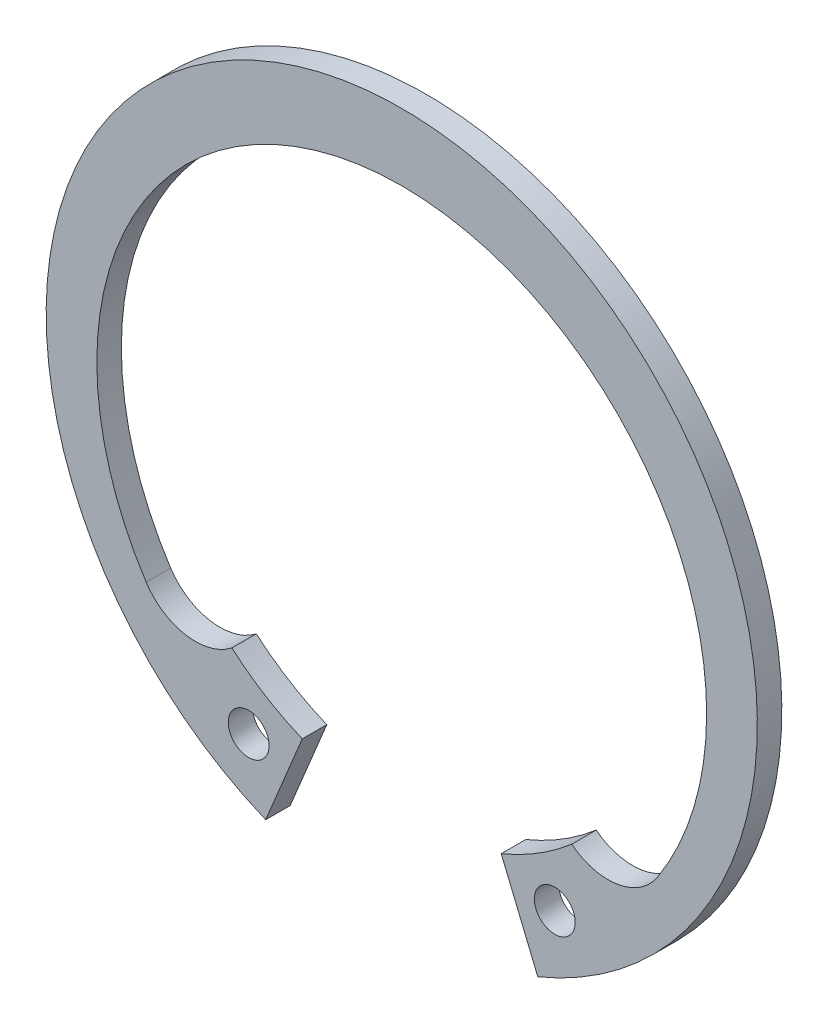
from build123d import *

# Parameters (mm, degrees)
SKETCH1_R  = 1.25
BODY_DEPTH = 1.5


with BuildPart() as part:
    # Sketch1 → Body (new body)
    with BuildSketch(Plane.XY):
        with BuildLine():
            Line((-6.084666575, -14.689684567), (-8.323364654, -20.094379832))
            ThreePointArc((-8.323364654, -20.094379832), (0, 21.75), (8.323364654, -20.094379832))
            Line((8.323364654, -20.094379832), (6.084666575, -14.689684567))
            ThreePointArc((6.084666575, -14.689684567), (8.346562025, -13.533103944), (10.395382608, -12.031044029))
            ThreePointArc((10.395382608, -12.031044029), (13.208382755, -12.751934045), (15.638324342, -11.161954131))
            ThreePointArc((15.638324342, -11.161954131), (0, 17.65), (-15.638324342, -11.161954131))
            ThreePointArc((-15.638324342, -11.161954131), (-13.208382755, -12.751934045), (-10.395382608, -12.031044029))
            ThreePointArc((-10.395382608, -12.031044029), (-8.346562025, -13.533103944), (-6.084666575, -14.689684567))
        make_face()
        with Locations(Location((9.363022706, -16.071521577, 0), (0, 0, 180))):
            Circle(SKETCH1_R, mode=Mode.SUBTRACT)
        with Locations((-9.363022706, -16.071521577)):
            Circle(SKETCH1_R, mode=Mode.SUBTRACT)
    extrude(amount=-BODY_DEPTH)


solid = part.part
